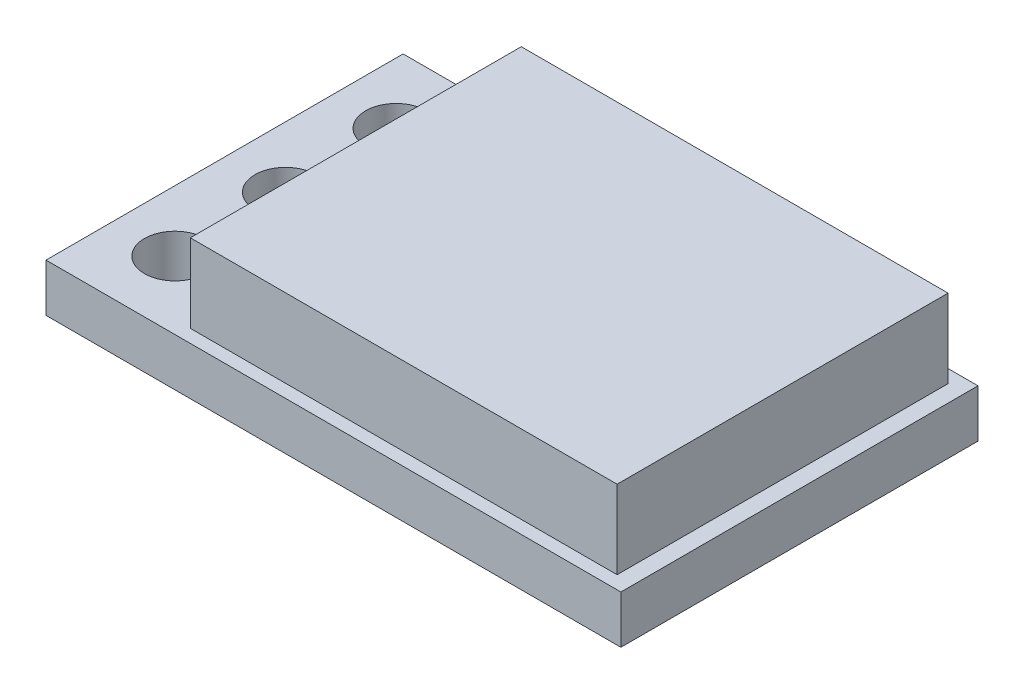
from build123d import *

# Parameters (mm, degrees)
SKETCH_1_W          = 13.2
SKETCH_1_H          = 8.2
EXTRUDE_1_DEPTH     = 1.1
SKETCH_3_W          = 9.8
SKETCH_3_H          = 7.6
EXTRUDE_2_DEPTH     = 1.8
SKETCH_2_R          = 0.7
CUT_EXTRUDE_1_DEPTH = 8.975587753


with BuildPart() as part:
    # Эскиз1 → Бобышка-Вытянуть1 (new body)
    with BuildSketch(Plane(origin=(0, 0, 0), x_dir=(1, 0, 0), z_dir=(0, 1, 0))):
        Rectangle(SKETCH_1_W, SKETCH_1_H)
    extrude(amount=EXTRUDE_1_DEPTH)

    # Эскиз3 → Бобышка-Вытянуть2 (add)
    with BuildSketch(Plane(origin=(0, 1.1, 0), x_dir=(1, 0, 0), z_dir=(0, 1, 0))):
        with Locations((1.313157895, 0)):
            Rectangle(SKETCH_3_W, SKETCH_3_H)
    extrude(amount=EXTRUDE_2_DEPTH)

    # Эскиз2 → Вырез-Вытянуть1 (cut, through all)
    with BuildSketch(Plane(origin=(0, 1.1, 0), x_dir=(1, 0, 0), z_dir=(0, 1, 0))):
        with Locations(Location((-5.2, -2.54, 0), (0, 0, 270))):
            Circle(SKETCH_2_R)
        with Locations(Location((-5.2, 0, 0), (0, 0, 270))):
            Circle(SKETCH_2_R)
        with Locations(Location((-5.2, 2.54, 0), (0, 0, 270))):
            Circle(SKETCH_2_R)
    extrude(amount=-CUT_EXTRUDE_1_DEPTH, mode=Mode.SUBTRACT)


solid = part.part
